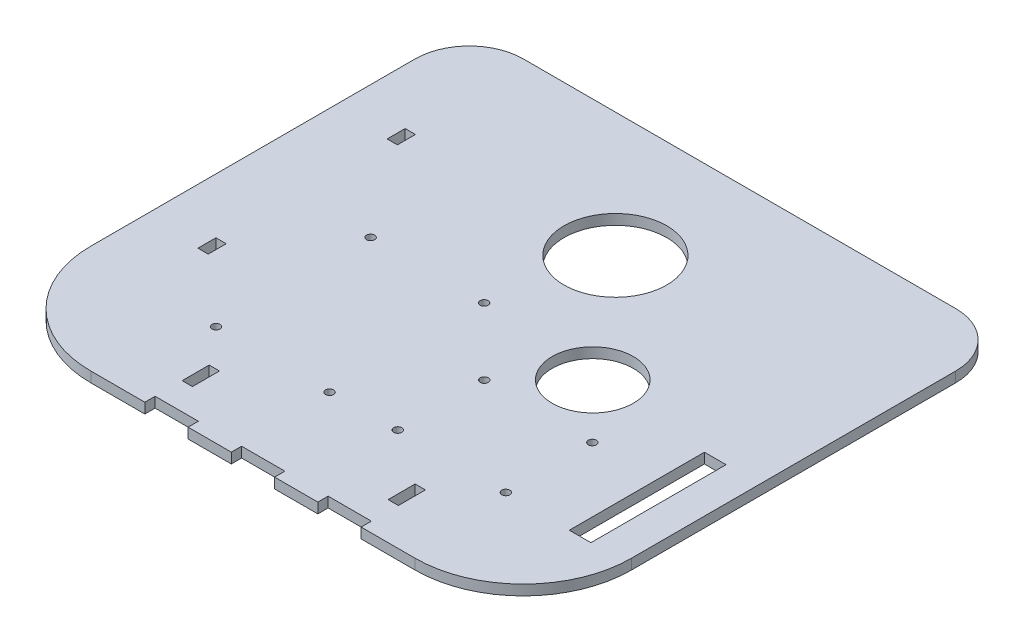
from build123d import *

# Parameters (mm, degrees)
SKETCH1_W           = 254
SKETCH1_H           = 228.6
BOSS_EXTRUDE1_DEPTH = 4.826
CUT_EXTRUDE3_DEPTH  = 4.826
SKETCH19_W          = 4.826
SKETCH19_H          = 8.466666666
CUT_EXTRUDE16_DEPTH = 171.929167423
FILLET11_R          = 50.8
SKETCH20_W          = 10.16
SKETCH20_H          = 63.5
CUT_EXTRUDE17_DEPTH = 171.929167423
SKETCH23_R          = 1.905
CUT_EXTRUDE18_DEPTH = 171.929167423
SKETCH24_W          = 20.32
SKETCH24_H          = 4.826
CUT_EXTRUDE19_DEPTH = 171.929167423
SKETCH26_R          = 24.13
CUT_EXTRUDE20_DEPTH = 171.929167423
SKETCH27_W          = 4.826
SKETCH27_H          = 12.7
CUT_EXTRUDE21_DEPTH = 171.929167423
SKETCH28_R          = 19.05
CUT_EXTRUDE22_DEPTH = 171.929167423


with BuildPart() as part:
    # Sketch1 → Boss-Extrude1 (new body)
    with BuildSketch(Plane(origin=(0, 0, 0), x_dir=(1, 0, 0), z_dir=(0, 1, 0))):
        Rectangle(SKETCH1_W, SKETCH1_H)
    extrude(amount=BOSS_EXTRUDE1_DEPTH)

    # Sketch4 → Cut-Extrude3 (cut)
    with BuildSketch(Plane(origin=(0, 4.826, 0), x_dir=(1, 0, 0), z_dir=(0, 1, 0))):
        with BuildLine():
            Line((-127, 88.9), (-127, 114.3))
            Line((-127, 114.3), (-101.6, 114.3))
            ThreePointArc((-101.6, 114.3), (-119.560512242, 106.860512242), (-127, 88.9))
        make_face()
        with BuildLine():
            Line((127, 88.9), (127, 114.3))
            Line((127, 114.3), (101.6, 114.3))
            ThreePointArc((101.6, 114.3), (119.560512242, 106.860512242), (127, 88.9))
        make_face()
    extrude(amount=-CUT_EXTRUDE3_DEPTH, mode=Mode.SUBTRACT)

    # Sketch19 → Cut-Extrude16 (cut, through all)
    with BuildSketch(Plane(origin=(0, 4.826, 0), x_dir=(1, 0, 0), z_dir=(0, 1, 0))):
        with Locations((-98.58699993, -34.925)):
            Rectangle(SKETCH19_W, SKETCH19_H)
        with Locations((-98.58699993, 53.975)):
            Rectangle(SKETCH19_W, SKETCH19_H)
    extrude(amount=-CUT_EXTRUDE16_DEPTH, mode=Mode.SUBTRACT)

    # Fillet11
    fillet11_edges = [part.edges().sort_by_distance(p)[0] for p in [
        (127, 2.413, 114.3),
        (-127, 2.413, 114.3),
    ]]
    fillet(fillet11_edges, radius=FILLET11_R)

    # Sketch20 → Cut-Extrude17 (cut, through all)
    with BuildSketch(Plane.XZ):
        with Locations((106.07999993, 34.925)):
            Rectangle(SKETCH20_W, SKETCH20_H)
    extrude(amount=-CUT_EXTRUDE17_DEPTH, mode=Mode.SUBTRACT)

    # Sketch23 → Cut-Extrude18 (cut, through all)
    with BuildSketch(Plane(origin=(0, 4.826, 0), x_dir=(1, 0, 0), z_dir=(0, 1, 0))):
        with Locations(Location((70.741119647, -25.576370111, 0), (0, 0, 270))):
            Circle(SKETCH23_R)
        with Locations(Location((70.741119647, -66.216370111, 0), (0, 0, 270))):
            Circle(SKETCH23_R)
        with Locations(Location((19.941119647, -25.576370111, 0), (0, 0, 270))):
            Circle(SKETCH23_R)
        with Locations(Location((19.941119647, -66.216370111, 0), (0, 0, 270))):
            Circle(SKETCH23_R)
        with Locations(Location((-11.48044922, 5.792629889, 0), (0, 0, 270))):
            Circle(SKETCH23_R)
        with Locations(Location((-64.82044922, 5.792629889, 0), (0, 0, 270))):
            Circle(SKETCH23_R)
        with Locations(Location((-64.82044922, -66.851370111, 0), (0, 0, 270))):
            Circle(SKETCH23_R)
        with Locations(Location((-11.48044922, -66.851370111, 0), (0, 0, 270))):
            Circle(SKETCH23_R)
    extrude(amount=-CUT_EXTRUDE18_DEPTH, mode=Mode.SUBTRACT)

    # Sketch24 → Cut-Extrude19 (cut, through all)
    with BuildSketch(Plane.XZ):
        with Locations((40.64, 111.887)):
            Rectangle(SKETCH24_W, SKETCH24_H)
        with Locations((-40.64, 111.887)):
            Rectangle(SKETCH24_W, SKETCH24_H)
        with Locations((0, 111.887)):
            Rectangle(SKETCH24_W, SKETCH24_H)
    extrude(amount=-CUT_EXTRUDE19_DEPTH, mode=Mode.SUBTRACT)

    # Sketch26 → Cut-Extrude20 (cut, through all)
    with BuildSketch(Plane.XZ):
        with Locations(Location((0, -55.982011538, 0), (0, 0, 270))):
            Circle(SKETCH26_R)
    extrude(amount=-CUT_EXTRUDE20_DEPTH, mode=Mode.SUBTRACT)

    # Sketch27 → Cut-Extrude21 (cut, through all)
    with BuildSketch(Plane.XZ):
        with Locations((-48.387, 90.424)):
            Rectangle(SKETCH27_W, SKETCH27_H)
        with Locations((48.387, 90.424)):
            Rectangle(SKETCH27_W, SKETCH27_H)
    extrude(amount=-CUT_EXTRUDE21_DEPTH, mode=Mode.SUBTRACT)

    # Sketch28 → Cut-Extrude22 (cut, through all)
    with BuildSketch(Plane(origin=(0, 4.826, 0), x_dir=(1, 0, 0), z_dir=(0, 1, 0))):
        with Locations(Location((45.341119647, 0, 0), (0, 0, 270))):
            Circle(SKETCH28_R)
    extrude(amount=-CUT_EXTRUDE22_DEPTH, mode=Mode.SUBTRACT)


solid = part.part
